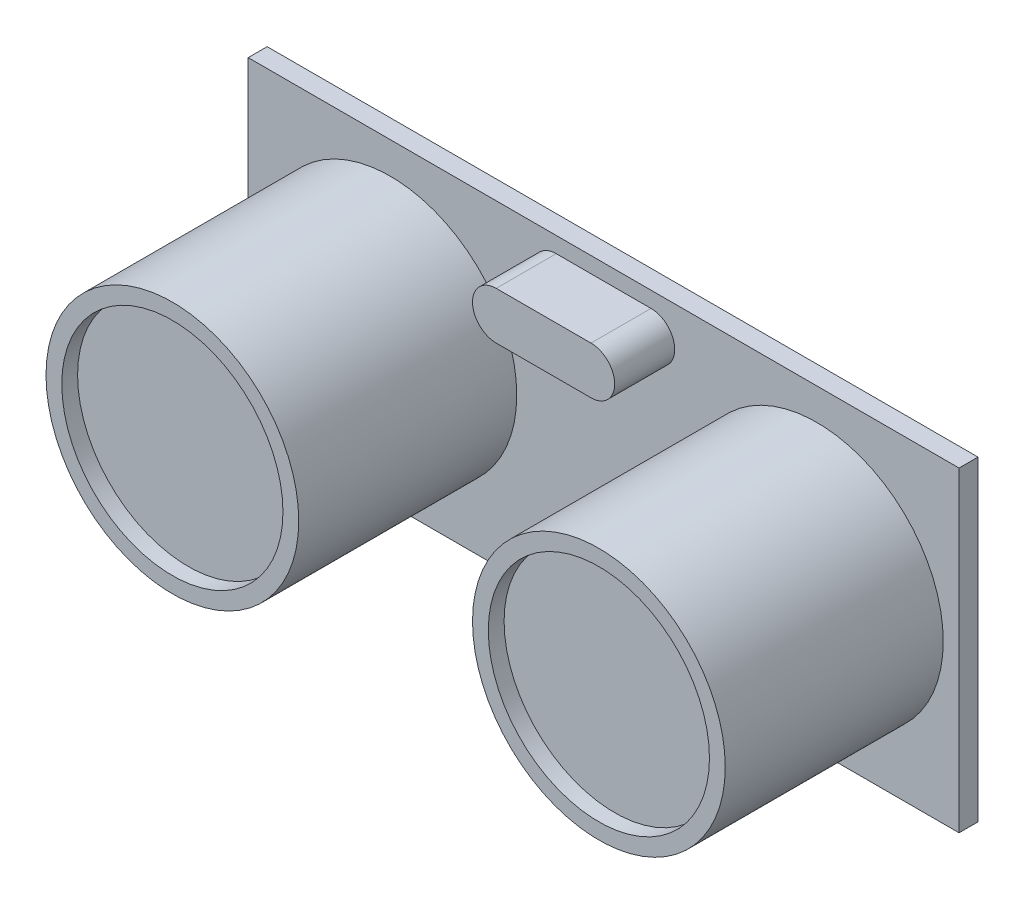
from build123d import *

# Parameters (mm, degrees)
SKETCH_1_W          = 45
SKETCH_1_H          = 20
EXTRUDE_1_DEPTH     = 1.2
SKETCH_2_R          = 8
EXTRUDE_2_DEPTH     = 15
EXTRUDE_3_DEPTH     = 5
CUT_EXTRUDE_START   = 15
SKETCH_5_R          = 7
CUT_EXTRUDE_1_DEPTH = 1


with BuildPart() as part:
    # 草图1 → 凸台-拉伸1 (new body)
    with BuildSketch(Plane.XY):
        Rectangle(SKETCH_1_W, SKETCH_1_H)
    extrude(amount=EXTRUDE_1_DEPTH)

    # 草图2 → 凸台-拉伸2 (add)
    with BuildSketch(Plane.XY):
        with Locations(Location((-13.5, 0, 0), (0, 0, 180))):
            Circle(SKETCH_2_R)
        with Locations(Location((13.5, 0, 0), (0, 0, 180))):
            Circle(SKETCH_2_R)
    extrude(amount=EXTRUDE_2_DEPTH)

    # 草图3 → 凸台-拉伸3 (add)
    with BuildSketch(Plane.XY):
        with BuildLine():
            Line((-3, 9), (3, 9))
            ThreePointArc((3, 9), (4.5, 7.5), (3, 6))
            Line((3, 6), (-3, 6))
            ThreePointArc((-3, 6), (-4.5, 7.5), (-3, 9))
        make_face()
    extrude(amount=EXTRUDE_3_DEPTH)

    # 草图5 → 切除-拉伸1 (cut)
    with BuildSketch(Plane.XY.offset(CUT_EXTRUDE_START)):
        with Locations((-13.5, 0)):
            Circle(SKETCH_5_R)
        with Locations((13.5, 0)):
            Circle(SKETCH_5_R)
    extrude(amount=-CUT_EXTRUDE_1_DEPTH, mode=Mode.SUBTRACT)


solid = part.part
